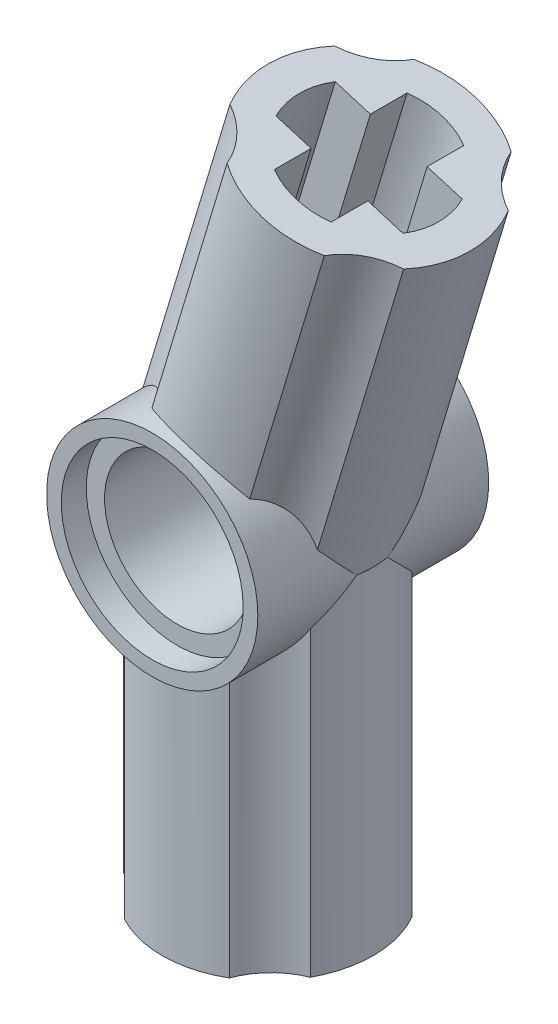
from build123d import *

# Parameters (mm, degrees)
CROQUIS1_R                   = 3.6
CROQUIS1_R_2                 = 3.1
SALIENTE_EXTRUIR1_DEPTH      = 7.87
SALIENTE_EXTRUIR2_START      = 0.85
CROQUIS1_3_R                 = 3.1
CROQUIS1_3_R_2               = 2.475
SALIENTE_EXTRUIR2_DEPTH      = 6.17
SALIENTE_EXTRUIR3_REACH      = 13.518
SALIENTE_EXTRUIR3_END_RADIUS = 3.6
SALIENTE_EXTRUIR4_START      = -8
SALIENTE_EXTRUIR4_DEPTH      = 8
SALIENTE_EXTRUIR5_REACH      = 20.306
SALIENTE_EXTRUIR5_END_RADIUS = 3.6
SALIENTE_EXTRUIR6_START      = -8
SALIENTE_EXTRUIR6_DEPTH      = 8


with BuildPart() as part:
    # Croquis1 → Saliente-Extruir1 (new body)
    with BuildSketch(Plane.XY):
        Circle(CROQUIS1_R)
        Circle(CROQUIS1_R_2, mode=Mode.SUBTRACT)
    extrude(amount=SALIENTE_EXTRUIR1_DEPTH)

    # Croquis1<3> → Saliente-Extruir2 (add)
    with BuildSketch(Plane.XY.offset(SALIENTE_EXTRUIR2_START)):
        Circle(CROQUIS1_3_R)
        Circle(CROQUIS1_3_R_2, mode=Mode.SUBTRACT)
    extrude(amount=SALIENTE_EXTRUIR2_DEPTH)

    # Saliente-Extruir3: up to this cylinder (the profile starts outside it)
    saliente_extruir3_end = Plane(origin=(0, 0, 6.19961), z_dir=(0, 0, -1)) * Cylinder(SALIENTE_EXTRUIR3_END_RADIUS, 35.236000000000004, mode=Mode.PRIVATE)
    # Croquis2 → Saliente-Extruir3 (add, up to the surface)
    with BuildSketch(Plane(origin=(0, -4, 0), x_dir=(1, 0, 0), z_dir=(0, 1, 0)), mode=Mode.PRIVATE) as saliente_extruir3_sk1:
        with BuildLine():
            ThreePointArc((-1.7124779696357202, -7.101610049171246), (0.05399392602494436, -7.534595068330939), (1.806684459564255, -7.048822612733265))
            ThreePointArc((1.806684459564255, -7.048822612733265), (2.337681630948243, -6.203587592595142), (3.1666100491712275, -5.647477969635754))
            ThreePointArc((3.1666100491712275, -5.647477969635754), (3.599595068330938, -3.881006073975069), (3.1138226127332604, -2.1283155404357355))
            ThreePointArc((3.1138226127332604, -2.1283155404357355), (2.268587592595135, -1.597318369051751), (1.7124779696357444, -0.7683899508287686))
            ThreePointArc((1.7124779696357444, -0.7683899508287686), (-0.0539939260249431, -0.3354049316690628), (-1.806684459564274, -0.8211773872667488))
            ThreePointArc((-1.806684459564274, -0.8211773872667488), (-2.337681630948256, -1.6664124074048765), (-3.166610049171237, -2.22252203036427))
            ThreePointArc((-3.166610049171237, -2.22252203036427), (-3.599595068330935, -3.9889939260249565), (-3.1138226127332462, -5.741684459564288))
            ThreePointArc((-3.1138226127332462, -5.741684459564288), (-2.268587592595116, -6.272681630948267), (-1.7124779696357202, -7.101610049171246))
        make_face()
        with BuildLine():
            Line((-1.01, -6.194540882568846), (-1.01, -4.944999999999999))
            Line((-1.01, -4.944999999999999), (-2.2595408825688463, -4.944999999999999))
            ThreePointArc((-2.2595408825688463, -4.944999999999999), (-2.475, -3.9349999999999996), (-2.2595408825688463, -2.9250000000000007))
            Line((-2.2595408825688463, -2.9250000000000007), (-1.01, -2.9250000000000007))
            Line((-1.01, -2.9250000000000007), (-1.01, -1.675459117431154))
            ThreePointArc((-1.01, -1.675459117431154), (1.5e-16, -1.4600000000000004), (1.01, -1.675459117431154))
            Line((1.01, -1.675459117431154), (1.01, -2.9250000000000007))
            Line((1.01, -2.9250000000000007), (2.2595408825688463, -2.9250000000000007))
            ThreePointArc((2.2595408825688463, -2.9250000000000007), (2.475, -3.935), (2.2595408825688463, -4.944999999999999))
            Line((2.2595408825688463, -4.944999999999999), (1.01, -4.944999999999999))
            Line((1.01, -4.944999999999999), (1.01, -6.194540882568846))
            ThreePointArc((1.01, -6.194540882568846), (1.5e-16, -6.41), (-1.01, -6.194540882568846))
        make_face(mode=Mode.SUBTRACT)
    saliente_extruir3_tool1 = extrude(saliente_extruir3_sk1.sketch, amount=SALIENTE_EXTRUIR3_REACH, mode=Mode.PRIVATE) - saliente_extruir3_end
    add(saliente_extruir3_tool1.solids().sort_by_distance((-2.197676, -4, 6.19961))[0])

    # Croquis2<3> → Saliente-Extruir4 (add)
    with BuildSketch(Plane(origin=(0, -4, 0), x_dir=(1, 0, 0), z_dir=(0, 1, 0)).offset(SALIENTE_EXTRUIR4_START)):
        with BuildLine():
            ThreePointArc((-3.166610049171237, -2.22252203036427), (-2.337681630948256, -1.6664124074048765), (-1.806684459564274, -0.8211773872667488))
            ThreePointArc((-1.806684459564274, -0.8211773872667488), (-0.0539939260249431, -0.3354049316690628), (1.7124779696357444, -0.7683899508287686))
            ThreePointArc((1.7124779696357444, -0.7683899508287686), (2.268587592595135, -1.597318369051751), (3.1138226127332604, -2.1283155404357355))
            ThreePointArc((3.1138226127332604, -2.1283155404357355), (3.599595068330938, -3.881006073975069), (3.1666100491712275, -5.647477969635754))
            ThreePointArc((3.1666100491712275, -5.647477969635754), (2.337681630948243, -6.203587592595142), (1.806684459564255, -7.048822612733265))
            ThreePointArc((1.806684459564255, -7.048822612733265), (0.05399392602494436, -7.534595068330939), (-1.7124779696357202, -7.101610049171246))
            ThreePointArc((-1.7124779696357202, -7.101610049171246), (-2.268587592595116, -6.272681630948267), (-3.1138226127332462, -5.741684459564288))
            ThreePointArc((-3.1138226127332462, -5.741684459564288), (-3.599595068330935, -3.9889939260249565), (-3.166610049171237, -2.22252203036427))
        make_face()
        with BuildLine():
            ThreePointArc((-2.2595408825688463, -2.9250000000000007), (-2.475, -3.9349999999999996), (-2.2595408825688463, -4.944999999999999))
            Line((-2.2595408825688463, -4.944999999999999), (-1.01, -4.944999999999999))
            Line((-1.01, -4.944999999999999), (-1.01, -6.194540882568846))
            ThreePointArc((-1.01, -6.194540882568846), (1.5e-16, -6.41), (1.01, -6.194540882568846))
            Line((1.01, -6.194540882568846), (1.01, -4.944999999999999))
            Line((1.01, -4.944999999999999), (2.2595408825688463, -4.944999999999999))
            ThreePointArc((2.2595408825688463, -4.944999999999999), (2.475, -3.935), (2.2595408825688463, -2.9250000000000007))
            Line((2.2595408825688463, -2.9250000000000007), (1.01, -2.9250000000000007))
            Line((1.01, -2.9250000000000007), (1.01, -1.675459117431154))
            ThreePointArc((1.01, -1.675459117431154), (1.5e-16, -1.4600000000000004), (-1.01, -1.675459117431154))
            Line((-1.01, -1.675459117431154), (-1.01, -2.9250000000000007))
            Line((-1.01, -2.9250000000000007), (-2.2595408825688463, -2.9250000000000007))
        make_face(mode=Mode.SUBTRACT)
    extrude(amount=SALIENTE_EXTRUIR4_DEPTH)

    # Saliente-Extruir5: up to this cylinder (the profile starts outside it)
    saliente_extruir5_end = Plane(origin=(0, 0, 3.935), z_dir=(0, 0, -1)) * Cylinder(SALIENTE_EXTRUIR5_END_RADIUS, 48.812000000000005, mode=Mode.PRIVATE)
    # Croquis7 → Saliente-Extruir5 (add, up to the surface)
    with BuildSketch(Plane(origin=(1.152785072536334, 3.830285443219265, 0), x_dir=(0, 0, 1), z_dir=(-0.2881962681340835, -0.9575713608048162, 0)), mode=Mode.PRIVATE) as saliente_extruir5_sk1:
        with BuildLine():
            ThreePointArc((2.222522030364279, -3.1666100491712452), (3.9889939260249445, -3.5995950683309377), (5.741684459564254, -3.113822612733264))
            ThreePointArc((5.741684459564254, -3.113822612733264), (6.272681630948287, -2.2685875925951686), (7.101610049171227, -1.7124779696357533))
            ThreePointArc((7.101610049171227, -1.7124779696357533), (7.534595068330938, 0.0539939260249318), (7.048822612733259, 1.8066844595642648))
            ThreePointArc((7.048822612733259, 1.8066844595642648), (6.203587592595132, 2.337681630948248), (5.647477969635745, 3.1666100491712332))
            ThreePointArc((5.647477969635745, 3.1666100491712332), (3.881006073975058, 3.599595068330939), (2.1283155404357252, 3.113822612733254))
            ThreePointArc((2.1283155404357252, 3.113822612733254), (1.5973183690517558, 2.268587592595114), (0.7683899508287607, 1.7124779696357326))
            ThreePointArc((0.7683899508287607, 1.7124779696357326), (0.33540493166906193, -0.05399392602495561), (0.8211773872667536, -1.8066844595642866))
            ThreePointArc((0.8211773872667536, -1.8066844595642866), (1.6664124074048823, -2.337681630948267), (2.222522030364279, -3.1666100491712452))
        make_face()
    saliente_extruir5_tool1 = extrude(saliente_extruir5_sk1.sketch, amount=SALIENTE_EXTRUIR5_REACH, mode=Mode.PRIVATE) - saliente_extruir5_end
    add(saliente_extruir5_tool1.solids().sort_by_distance((1.152785, 3.830285, 3.935))[0])

    # Croquis7<3> → Saliente-Extruir6 (add)
    with BuildSketch(Plane(origin=(1.152785072536334, 3.830285443219265, 0), x_dir=(0, 0, 1), z_dir=(-0.2881962681340835, -0.9575713608048162, 0)).offset(SALIENTE_EXTRUIR6_START)):
        with BuildLine():
            ThreePointArc((0.7683899508287607, 1.7124779696357326), (1.5973183690517558, 2.268587592595114), (2.1283155404357252, 3.113822612733254))
            ThreePointArc((2.1283155404357252, 3.113822612733254), (3.881006073975058, 3.599595068330939), (5.647477969635745, 3.1666100491712332))
            ThreePointArc((5.647477969635745, 3.1666100491712332), (6.203587592595132, 2.337681630948248), (7.048822612733259, 1.8066844595642648))
            ThreePointArc((7.048822612733259, 1.8066844595642648), (7.534595068330938, 0.0539939260249318), (7.101610049171227, -1.7124779696357533))
            ThreePointArc((7.101610049171227, -1.7124779696357533), (6.272681630948287, -2.2685875925951686), (5.741684459564254, -3.113822612733264))
            ThreePointArc((5.741684459564254, -3.113822612733264), (3.9889939260249445, -3.5995950683309377), (2.222522030364279, -3.1666100491712452))
            ThreePointArc((2.222522030364279, -3.1666100491712452), (1.6664124074048823, -2.337681630948267), (0.8211773872667536, -1.8066844595642866))
            ThreePointArc((0.8211773872667536, -1.8066844595642866), (0.33540493166906193, -0.05399392602495561), (0.7683899508287607, 1.7124779696357326))
        make_face()
        with BuildLine():
            ThreePointArc((1.675459117431154, 1.010000000000001), (1.4600000000000004, 1.17e-15), (1.675459117431154, -1.0099999999999991))
            Line((1.675459117431154, -1.0099999999999991), (2.925, -1.0099999999999991))
            Line((2.925, -1.0099999999999991), (2.925, -2.2595408825688454))
            ThreePointArc((2.925, -2.2595408825688454), (3.934999999999999, -2.474999999999999), (4.944999999999999, -2.259540882568846))
            Line((4.944999999999999, -2.259540882568846), (4.944999999999999, -1.009999999999999))
            Line((4.944999999999999, -1.009999999999999), (6.194540882568846, -1.0099999999999987))
            ThreePointArc((6.194540882568846, -1.0099999999999987), (6.41, 1e-15), (6.194540882568846, 1.010000000000001))
            Line((6.194540882568846, 1.010000000000001), (4.944999999999999, 1.010000000000001))
            Line((4.944999999999999, 1.010000000000001), (4.944999999999999, 2.259540882568847))
            ThreePointArc((4.944999999999999, 2.259540882568847), (3.9349999999999996, 2.475000000000001), (2.925, 2.2595408825688468))
            Line((2.925, 2.2595408825688468), (2.925, 1.010000000000001))
            Line((2.925, 1.010000000000001), (1.675459117431154, 1.010000000000001))
        make_face(mode=Mode.SUBTRACT)
    extrude(amount=SALIENTE_EXTRUIR6_DEPTH)


solid = part.part
